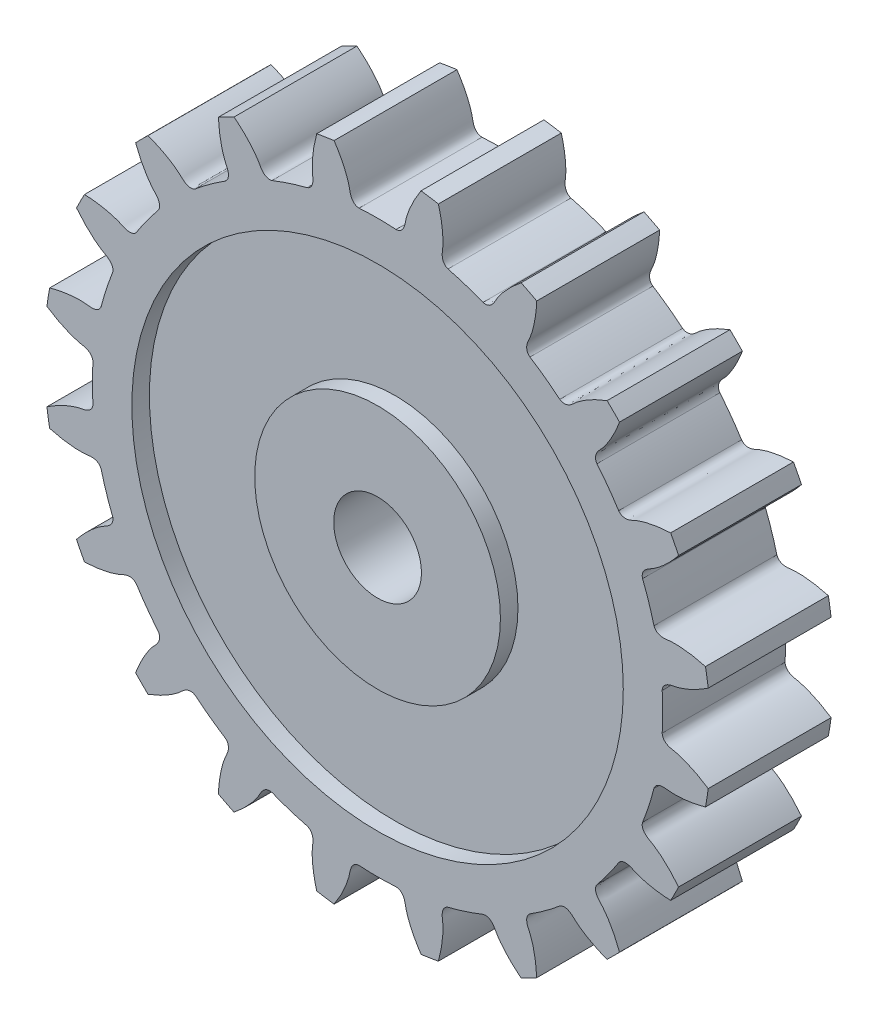
from build123d import *

# Parameters (mm, degrees)
CROQUIS1_R              = 2.5
SALIENTE_EXTRUIR1_DEPTH = 7
CROQUIS2_R              = 14
CROQUIS2_R_2            = 7
CORTAR_EXTRUIR1_DEPTH   = 1
CORTAR_EXTRUIR2_START   = -1
CROQUIS3_R              = 14
CROQUIS3_R_2            = 7
CORTAR_EXTRUIR2_DEPTH   = 1


with BuildPart() as part:
    # Croquis1 → Saliente-Extruir1 (new body)
    with BuildSketch(Plane.XY):
        with BuildLine():
            ThreePointArc((6.009338484, 15.098024738), (5.021526159, 15.45466839), (4.012739321, 15.746759131))
            add(Edge.make_bspline(
                [(4.012739321, 15.746759131), (3.946115444, 15.769102329), (3.844071312, 15.832245409), (3.753150436, 15.958574818), (3.709049528, 16.068220448), (3.687336313, 16.171871712), (3.679630722, 16.27329844), (3.681699682, 16.352274965), (3.686361582, 16.409563995), (3.690140505, 16.445010565), (3.695527746, 16.484388184), (3.704084221, 16.544422236), (3.713446112, 16.632533556), (3.721941557, 16.752412041), (3.726649101, 16.89437231), (3.726023288, 17.058257781), (3.718404355, 17.243841257), (3.702184036, 17.450797585), (3.675756229, 17.678713454), (3.637539698, 17.927084936), (3.572554469, 18.265123942), (3.510335789, 18.518138446), (3.465069654, 18.681362164)],
                knots=[0.032345382, 0.032345382, 0.032345382, 0.032345382, 0.098318952, 0.140640605, 0.17619302, 0.208307484, 0.239484432, 0.271287113, 0.282206678, 0.293329329, 0.304676551, 0.319437818, 0.350137192, 0.387658647, 0.432002182, 0.483167798, 0.541155495, 0.605965273, 0.677597132, 0.756051072, 0.841327094, 1, 1, 1, 1], degree=3))
            ThreePointArc((3.465069654, 18.681362164), (2.972254836, 18.766078471), (2.477381313, 18.837796629))
            add(Edge.make_bspline(
                [(2.477381313, 18.837796629), (2.383891758, 18.696549653), (2.246532494, 18.47514519), (2.080268072, 18.173732531), (1.967170982, 17.949326772), (1.871606768, 17.740732541), (1.792227304, 17.548917731), (1.727632821, 17.374771737), (1.676394242, 17.219100778), (1.637003247, 17.082633828), (1.608038406, 16.965997377), (1.589714197, 16.879305549), (1.579300347, 16.819565676), (1.572255564, 16.780450587), (1.564895941, 16.745571144), (1.551626388, 16.689645432), (1.529188997, 16.613894949), (1.490517962, 16.519813557), (1.437837465, 16.427945099), (1.362012645, 16.337293839), (1.23650382, 16.245243527), (1.119941798, 16.216724261), (1.049674299, 16.216062527)],
                knots=[0, 0, 0, 0, 0.158672906, 0.243948928, 0.322402868, 0.394034727, 0.458844505, 0.516832202, 0.567997818, 0.612341353, 0.649862808, 0.680562182, 0.695323449, 0.706670671, 0.717793322, 0.728712887, 0.760515568, 0.791692516, 0.82380698, 0.859359395, 0.901681048, 0.967654618, 0.967654618, 0.967654618, 0.967654618], degree=3))
            ThreePointArc((1.049674299, 16.216062527), (0, 16.25), (-1.049674299, 16.216062527))
            add(Edge.make_bspline(
                [(-1.049674299, 16.216062527), (-1.119941798, 16.216724261), (-1.23650382, 16.245243527), (-1.362012645, 16.337293839), (-1.437837465, 16.427945099), (-1.490517962, 16.519813557), (-1.529188997, 16.613894949), (-1.551626388, 16.689645432), (-1.564895941, 16.745571144), (-1.572255564, 16.780450587), (-1.579300347, 16.819565676), (-1.589714197, 16.879305549), (-1.608038406, 16.965997377), (-1.637003247, 17.082633828), (-1.676394242, 17.219100778), (-1.727632821, 17.374771737), (-1.792227304, 17.548917731), (-1.871606768, 17.740732541), (-1.967170982, 17.949326772), (-2.080268072, 18.173732531), (-2.246532494, 18.47514519), (-2.383891758, 18.696549653), (-2.477381313, 18.837796629)],
                knots=[0.032345382, 0.032345382, 0.032345382, 0.032345382, 0.098318952, 0.140640605, 0.17619302, 0.208307484, 0.239484432, 0.271287113, 0.282206678, 0.293329329, 0.304676551, 0.319437818, 0.350137192, 0.387658647, 0.432002182, 0.483167798, 0.541155495, 0.605965273, 0.677597132, 0.756051072, 0.841327094, 1, 1, 1, 1], degree=3))
            ThreePointArc((-2.477381313, 18.837796629), (-2.972254836, 18.766078471), (-3.465069654, 18.681362164))
            add(Edge.make_bspline(
                [(-3.465069654, 18.681362164), (-3.510335789, 18.518138446), (-3.572554469, 18.265123942), (-3.637539698, 17.927084936), (-3.675756229, 17.678713454), (-3.702184036, 17.450797585), (-3.718404355, 17.243841257), (-3.726023288, 17.058257781), (-3.726649101, 16.89437231), (-3.721941557, 16.752412041), (-3.713446112, 16.632533556), (-3.704084221, 16.544422236), (-3.695527746, 16.484388184), (-3.690140505, 16.445010565), (-3.686361582, 16.409563995), (-3.681699682, 16.352274965), (-3.679630722, 16.27329844), (-3.687336313, 16.171871712), (-3.709049528, 16.068220448), (-3.753150436, 15.958574818), (-3.844071312, 15.832245409), (-3.946115444, 15.769102329), (-4.012739321, 15.746759131)],
                knots=[0, 0, 0, 0, 0.158672906, 0.243948928, 0.322402868, 0.394034727, 0.458844505, 0.516832202, 0.567997818, 0.612341353, 0.649862808, 0.680562182, 0.695323449, 0.706670671, 0.717793322, 0.728712887, 0.760515568, 0.791692516, 0.82380698, 0.859359395, 0.901681048, 0.967654618, 0.967654618, 0.967654618, 0.967654618], degree=3))
            ThreePointArc((-4.012739321, 15.746759131), (-5.021526159, 15.45466839), (-6.009338484, 15.098024738))
            add(Edge.make_bspline(
                [(-6.009338484, 15.098024738), (-6.076371335, 15.076940233), (-6.196041343, 15.068044021), (-6.34385244, 15.11680471), (-6.443978909, 15.179588024), (-6.522469953, 15.25068095), (-6.588321042, 15.328207665), (-6.633068455, 15.39331712), (-6.662970546, 15.442405115), (-6.680748304, 15.473303188), (-6.699535518, 15.508326891), (-6.727900314, 15.561924829), (-6.77211692, 15.638711166), (-6.835706767, 15.740688395), (-6.915340436, 15.85830369), (-7.012176192, 15.990521978), (-7.127423268, 16.136183867), (-7.26219166, 16.294080989), (-7.417537791, 16.462934926), (-7.594444709, 16.641408562), (-7.845713205, 16.876690503), (-8.044767369, 17.044812314), (-8.177328936, 17.150256309)],
                knots=[0.032345382, 0.032345382, 0.032345382, 0.032345382, 0.098318952, 0.140640605, 0.17619302, 0.208307484, 0.239484432, 0.271287113, 0.282206678, 0.293329329, 0.304676551, 0.319437818, 0.350137192, 0.387658647, 0.432002182, 0.483167798, 0.541155495, 0.605965273, 0.677597132, 0.756051072, 0.841327094, 1, 1, 1, 1], degree=3))
            ThreePointArc((-8.177328936, 17.150256309), (-8.625819495, 16.92912396), (-9.06833546, 16.696265809))
            add(Edge.make_bspline(
                [(-9.06833546, 16.696265809), (-9.06094721, 16.527042824), (-9.04193491, 16.267185101), (-8.999279738, 15.925609363), (-8.95887481, 15.677584488), (-8.913579271, 15.452656974), (-8.865052689, 15.250817455), (-8.814950277, 15.071962702), (-8.764902064, 14.915904969), (-8.716556788, 14.782347442), (-8.671432651, 14.670961465), (-8.635301069, 14.590055603), (-8.608611834, 14.535603923), (-8.591319911, 14.499818331), (-8.576772349, 14.467274391), (-8.554635334, 14.414229892), (-8.528262548, 14.339758097), (-8.504248418, 14.240914387), (-8.49286891, 14.135626425), (-8.500929004, 14.017719304), (-8.548361961, 13.869476801), (-8.625899413, 13.777890793), (-8.682358057, 13.736053238)],
                knots=[0, 0, 0, 0, 0.158672906, 0.243948928, 0.322402868, 0.394034727, 0.458844505, 0.516832202, 0.567997818, 0.612341353, 0.649862808, 0.680562182, 0.695323449, 0.706670671, 0.717793322, 0.728712887, 0.760515568, 0.791692516, 0.82380698, 0.859359395, 0.901681048, 0.967654618, 0.967654618, 0.967654618, 0.967654618], degree=3))
            ThreePointArc((-8.682358057, 13.736053238), (-9.55151035, 13.146526159), (-10.38076675, 12.502087093))
            add(Edge.make_bspline(
                [(-10.38076675, 12.502087093), (-10.438003309, 12.461320247), (-10.549067169, 12.415879381), (-10.704711757, 12.416577411), (-10.819338799, 12.445347111), (-10.915957141, 12.488705435), (-11.00254232, 12.542088616), (-11.065219567, 12.590183677), (-11.10882717, 12.62762888), (-11.135282852, 12.651521064), (-11.163973475, 12.679025017), (-11.207512672, 12.721234482), (-11.273293447, 12.780598945), (-11.365283681, 12.857934709), (-11.477364926, 12.945185345), (-11.610318901, 13.041008515), (-11.764937383, 13.143927899), (-11.941902634, 13.252451262), (-12.141824321, 13.365036305), (-12.365224184, 13.480107575), (-12.676900843, 13.626227763), (-12.9181651, 13.724609987), (-13.076822628, 13.783929409)],
                knots=[0.032345382, 0.032345382, 0.032345382, 0.032345382, 0.098318952, 0.140640605, 0.17619302, 0.208307484, 0.239484432, 0.271287113, 0.282206678, 0.293329329, 0.304676551, 0.319437818, 0.350137192, 0.387658647, 0.432002182, 0.483167798, 0.541155495, 0.605965273, 0.677597132, 0.756051072, 0.841327094, 1, 1, 1, 1], degree=3))
            ThreePointArc((-13.076822628, 13.783929409), (-13.435028843, 13.435028843), (-13.783929409, 13.076822628))
            add(Edge.make_bspline(
                [(-13.783929409, 13.076822628), (-13.724609987, 12.9181651), (-13.626227763, 12.676900843), (-13.480107575, 12.365224184), (-13.365036305, 12.141824321), (-13.252451262, 11.941902634), (-13.143927899, 11.764937383), (-13.041008515, 11.610318901), (-12.945185345, 11.477364926), (-12.857934709, 11.365283681), (-12.780598945, 11.273293447), (-12.721234482, 11.207512672), (-12.679025017, 11.163973475), (-12.651521064, 11.135282852), (-12.62762888, 11.10882717), (-12.590183677, 11.065219567), (-12.542088616, 11.00254232), (-12.488705435, 10.915957141), (-12.445347111, 10.819338799), (-12.416577411, 10.704711757), (-12.415879381, 10.549067169), (-12.461320247, 10.438003309), (-12.502087093, 10.38076675)],
                knots=[0, 0, 0, 0, 0.158672906, 0.243948928, 0.322402868, 0.394034727, 0.458844505, 0.516832202, 0.567997818, 0.612341353, 0.649862808, 0.680562182, 0.695323449, 0.706670671, 0.717793322, 0.728712887, 0.760515568, 0.791692516, 0.82380698, 0.859359395, 0.901681048, 0.967654618, 0.967654618, 0.967654618, 0.967654618], degree=3))
            ThreePointArc((-12.502087093, 10.38076675), (-13.146526159, 9.55151035), (-13.736053238, 8.682358057))
            add(Edge.make_bspline(
                [(-13.736053238, 8.682358057), (-13.777890793, 8.625899413), (-13.869476801, 8.548361961), (-14.017719304, 8.500929004), (-14.135626425, 8.49286891), (-14.240914387, 8.504248418), (-14.339758097, 8.528262548), (-14.414229892, 8.554635334), (-14.467274391, 8.576772349), (-14.499818331, 8.591319911), (-14.535603923, 8.608611834), (-14.590055603, 8.635301069), (-14.670961465, 8.671432651), (-14.782347442, 8.716556788), (-14.915904969, 8.764902064), (-15.071962702, 8.814950277), (-15.250817455, 8.865052689), (-15.452656974, 8.913579271), (-15.677584488, 8.95887481), (-15.925609363, 8.999279738), (-16.267185101, 9.04193491), (-16.527042824, 9.06094721), (-16.696265809, 9.06833546)],
                knots=[0.032345382, 0.032345382, 0.032345382, 0.032345382, 0.098318952, 0.140640605, 0.17619302, 0.208307484, 0.239484432, 0.271287113, 0.282206678, 0.293329329, 0.304676551, 0.319437818, 0.350137192, 0.387658647, 0.432002182, 0.483167798, 0.541155495, 0.605965273, 0.677597132, 0.756051072, 0.841327094, 1, 1, 1, 1], degree=3))
            ThreePointArc((-16.696265809, 9.06833546), (-16.92912396, 8.625819495), (-17.150256309, 8.177328936))
            add(Edge.make_bspline(
                [(-17.150256309, 8.177328936), (-17.044812314, 8.044767369), (-16.876690503, 7.845713205), (-16.641408562, 7.594444709), (-16.462934926, 7.417537791), (-16.294080989, 7.26219166), (-16.136183867, 7.127423268), (-15.990521978, 7.012176192), (-15.85830369, 6.915340436), (-15.740688395, 6.835706767), (-15.638711166, 6.77211692), (-15.561924829, 6.727900314), (-15.508326891, 6.699535518), (-15.473303188, 6.680748304), (-15.442405115, 6.662970546), (-15.39331712, 6.633068455), (-15.328207665, 6.588321042), (-15.25068095, 6.522469953), (-15.179588024, 6.443978909), (-15.11680471, 6.34385244), (-15.068044021, 6.196041343), (-15.076940233, 6.076371335), (-15.098024738, 6.009338484)],
                knots=[0, 0, 0, 0, 0.158672906, 0.243948928, 0.322402868, 0.394034727, 0.458844505, 0.516832202, 0.567997818, 0.612341353, 0.649862808, 0.680562182, 0.695323449, 0.706670671, 0.717793322, 0.728712887, 0.760515568, 0.791692516, 0.82380698, 0.859359395, 0.901681048, 0.967654618, 0.967654618, 0.967654618, 0.967654618], degree=3))
            ThreePointArc((-15.098024738, 6.009338484), (-15.45466839, 5.021526159), (-15.746759131, 4.012739321))
            add(Edge.make_bspline(
                [(-15.746759131, 4.012739321), (-15.769102329, 3.946115444), (-15.832245409, 3.844071312), (-15.958574818, 3.753150436), (-16.068220448, 3.709049528), (-16.171871712, 3.687336313), (-16.27329844, 3.679630722), (-16.352274965, 3.681699682), (-16.409563995, 3.686361582), (-16.445010565, 3.690140505), (-16.484388184, 3.695527746), (-16.544422236, 3.704084221), (-16.632533556, 3.713446112), (-16.752412041, 3.721941557), (-16.89437231, 3.726649101), (-17.058257781, 3.726023288), (-17.243841257, 3.718404355), (-17.450797585, 3.702184036), (-17.678713454, 3.675756229), (-17.927084936, 3.637539698), (-18.265123942, 3.572554469), (-18.518138446, 3.510335789), (-18.681362164, 3.465069654)],
                knots=[0.032345382, 0.032345382, 0.032345382, 0.032345382, 0.098318952, 0.140640605, 0.17619302, 0.208307484, 0.239484432, 0.271287113, 0.282206678, 0.293329329, 0.304676551, 0.319437818, 0.350137192, 0.387658647, 0.432002182, 0.483167798, 0.541155495, 0.605965273, 0.677597132, 0.756051072, 0.841327094, 1, 1, 1, 1], degree=3))
            ThreePointArc((-18.681362164, 3.465069654), (-18.766078471, 2.972254836), (-18.837796629, 2.477381313))
            add(Edge.make_bspline(
                [(-18.837796629, 2.477381313), (-18.696549653, 2.383891758), (-18.47514519, 2.246532494), (-18.173732531, 2.080268072), (-17.949326772, 1.967170982), (-17.740732541, 1.871606768), (-17.548917731, 1.792227304), (-17.374771737, 1.727632821), (-17.219100778, 1.676394242), (-17.082633828, 1.637003247), (-16.965997377, 1.608038406), (-16.879305549, 1.589714197), (-16.819565676, 1.579300347), (-16.780450587, 1.572255564), (-16.745571144, 1.564895941), (-16.689645432, 1.551626388), (-16.613894949, 1.529188997), (-16.519813557, 1.490517962), (-16.427945099, 1.437837465), (-16.337293839, 1.362012645), (-16.245243527, 1.23650382), (-16.216724261, 1.119941798), (-16.216062527, 1.049674299)],
                knots=[0, 0, 0, 0, 0.158672906, 0.243948928, 0.322402868, 0.394034727, 0.458844505, 0.516832202, 0.567997818, 0.612341353, 0.649862808, 0.680562182, 0.695323449, 0.706670671, 0.717793322, 0.728712887, 0.760515568, 0.791692516, 0.82380698, 0.859359395, 0.901681048, 0.967654618, 0.967654618, 0.967654618, 0.967654618], degree=3))
            ThreePointArc((-16.216062527, 1.049674299), (-16.25, 0), (-16.216062527, -1.049674299))
            add(Edge.make_bspline(
                [(-16.216062527, -1.049674299), (-16.216724261, -1.119941798), (-16.245243527, -1.23650382), (-16.337293839, -1.362012645), (-16.427945099, -1.437837465), (-16.519813557, -1.490517962), (-16.613894949, -1.529188997), (-16.689645432, -1.551626388), (-16.745571144, -1.564895941), (-16.780450587, -1.572255564), (-16.819565676, -1.579300347), (-16.879305549, -1.589714197), (-16.965997377, -1.608038406), (-17.082633828, -1.637003247), (-17.219100778, -1.676394242), (-17.374771737, -1.727632821), (-17.548917731, -1.792227304), (-17.740732541, -1.871606768), (-17.949326772, -1.967170982), (-18.173732531, -2.080268072), (-18.47514519, -2.246532494), (-18.696549653, -2.383891758), (-18.837796629, -2.477381313)],
                knots=[0.032345382, 0.032345382, 0.032345382, 0.032345382, 0.098318952, 0.140640605, 0.17619302, 0.208307484, 0.239484432, 0.271287113, 0.282206678, 0.293329329, 0.304676551, 0.319437818, 0.350137192, 0.387658647, 0.432002182, 0.483167798, 0.541155495, 0.605965273, 0.677597132, 0.756051072, 0.841327094, 1, 1, 1, 1], degree=3))
            ThreePointArc((-18.837796629, -2.477381313), (-18.766078471, -2.972254836), (-18.681362164, -3.465069654))
            add(Edge.make_bspline(
                [(-18.681362164, -3.465069654), (-18.518138446, -3.510335789), (-18.265123942, -3.572554469), (-17.927084936, -3.637539698), (-17.678713454, -3.675756229), (-17.450797585, -3.702184036), (-17.243841257, -3.718404355), (-17.058257781, -3.726023288), (-16.89437231, -3.726649101), (-16.752412041, -3.721941557), (-16.632533556, -3.713446112), (-16.544422236, -3.704084221), (-16.484388184, -3.695527746), (-16.445010565, -3.690140505), (-16.409563995, -3.686361582), (-16.352274965, -3.681699682), (-16.27329844, -3.679630722), (-16.171871712, -3.687336313), (-16.068220448, -3.709049528), (-15.958574818, -3.753150436), (-15.832245409, -3.844071312), (-15.769102329, -3.946115444), (-15.746759131, -4.012739321)],
                knots=[0, 0, 0, 0, 0.158672906, 0.243948928, 0.322402868, 0.394034727, 0.458844505, 0.516832202, 0.567997818, 0.612341353, 0.649862808, 0.680562182, 0.695323449, 0.706670671, 0.717793322, 0.728712887, 0.760515568, 0.791692516, 0.82380698, 0.859359395, 0.901681048, 0.967654618, 0.967654618, 0.967654618, 0.967654618], degree=3))
            ThreePointArc((-15.746759131, -4.012739321), (-15.45466839, -5.021526159), (-15.098024738, -6.009338484))
            add(Edge.make_bspline(
                [(-15.098024738, -6.009338484), (-15.076940233, -6.076371335), (-15.068044021, -6.196041343), (-15.11680471, -6.34385244), (-15.179588024, -6.443978909), (-15.25068095, -6.522469953), (-15.328207665, -6.588321042), (-15.39331712, -6.633068455), (-15.442405115, -6.662970546), (-15.473303188, -6.680748304), (-15.508326891, -6.699535518), (-15.561924829, -6.727900314), (-15.638711166, -6.77211692), (-15.740688395, -6.835706767), (-15.85830369, -6.915340436), (-15.990521978, -7.012176192), (-16.136183867, -7.127423268), (-16.294080989, -7.26219166), (-16.462934926, -7.417537791), (-16.641408562, -7.594444709), (-16.876690503, -7.845713205), (-17.044812314, -8.044767369), (-17.150256309, -8.177328936)],
                knots=[0.032345382, 0.032345382, 0.032345382, 0.032345382, 0.098318952, 0.140640605, 0.17619302, 0.208307484, 0.239484432, 0.271287113, 0.282206678, 0.293329329, 0.304676551, 0.319437818, 0.350137192, 0.387658647, 0.432002182, 0.483167798, 0.541155495, 0.605965273, 0.677597132, 0.756051072, 0.841327094, 1, 1, 1, 1], degree=3))
            ThreePointArc((-17.150256309, -8.177328936), (-16.92912396, -8.625819495), (-16.696265809, -9.06833546))
            add(Edge.make_bspline(
                [(-16.696265809, -9.06833546), (-16.527042824, -9.06094721), (-16.267185101, -9.04193491), (-15.925609363, -8.999279738), (-15.677584488, -8.95887481), (-15.452656974, -8.913579271), (-15.250817455, -8.865052689), (-15.071962702, -8.814950277), (-14.915904969, -8.764902064), (-14.782347442, -8.716556788), (-14.670961465, -8.671432651), (-14.590055603, -8.635301069), (-14.535603923, -8.608611834), (-14.499818331, -8.591319911), (-14.467274391, -8.576772349), (-14.414229892, -8.554635334), (-14.339758097, -8.528262548), (-14.240914387, -8.504248418), (-14.135626425, -8.49286891), (-14.017719304, -8.500929004), (-13.869476801, -8.548361961), (-13.777890793, -8.625899413), (-13.736053238, -8.682358057)],
                knots=[0, 0, 0, 0, 0.158672906, 0.243948928, 0.322402868, 0.394034727, 0.458844505, 0.516832202, 0.567997818, 0.612341353, 0.649862808, 0.680562182, 0.695323449, 0.706670671, 0.717793322, 0.728712887, 0.760515568, 0.791692516, 0.82380698, 0.859359395, 0.901681048, 0.967654618, 0.967654618, 0.967654618, 0.967654618], degree=3))
            ThreePointArc((-13.736053238, -8.682358057), (-13.146526159, -9.55151035), (-12.502087093, -10.38076675))
            add(Edge.make_bspline(
                [(-12.502087093, -10.38076675), (-12.461320247, -10.438003309), (-12.415879381, -10.549067169), (-12.416577411, -10.704711757), (-12.445347111, -10.819338799), (-12.488705435, -10.915957141), (-12.542088616, -11.00254232), (-12.590183677, -11.065219567), (-12.62762888, -11.10882717), (-12.651521064, -11.135282852), (-12.679025017, -11.163973475), (-12.721234482, -11.207512672), (-12.780598945, -11.273293447), (-12.857934709, -11.365283681), (-12.945185345, -11.477364926), (-13.041008515, -11.610318901), (-13.143927899, -11.764937383), (-13.252451262, -11.941902634), (-13.365036305, -12.141824321), (-13.480107575, -12.365224184), (-13.626227763, -12.676900843), (-13.724609987, -12.9181651), (-13.783929409, -13.076822628)],
                knots=[0.032345382, 0.032345382, 0.032345382, 0.032345382, 0.098318952, 0.140640605, 0.17619302, 0.208307484, 0.239484432, 0.271287113, 0.282206678, 0.293329329, 0.304676551, 0.319437818, 0.350137192, 0.387658647, 0.432002182, 0.483167798, 0.541155495, 0.605965273, 0.677597132, 0.756051072, 0.841327094, 1, 1, 1, 1], degree=3))
            ThreePointArc((-13.783929409, -13.076822628), (-13.435028843, -13.435028843), (-13.076822628, -13.783929409))
            add(Edge.make_bspline(
                [(-13.076822628, -13.783929409), (-12.9181651, -13.724609987), (-12.676900843, -13.626227763), (-12.365224184, -13.480107575), (-12.141824321, -13.365036305), (-11.941902634, -13.252451262), (-11.764937383, -13.143927899), (-11.610318901, -13.041008515), (-11.477364926, -12.945185345), (-11.365283681, -12.857934709), (-11.273293447, -12.780598945), (-11.207512672, -12.721234482), (-11.163973475, -12.679025017), (-11.135282852, -12.651521064), (-11.10882717, -12.62762888), (-11.065219567, -12.590183677), (-11.00254232, -12.542088616), (-10.915957141, -12.488705435), (-10.819338799, -12.445347111), (-10.704711757, -12.416577411), (-10.549067169, -12.415879381), (-10.438003309, -12.461320247), (-10.38076675, -12.502087093)],
                knots=[0, 0, 0, 0, 0.158672906, 0.243948928, 0.322402868, 0.394034727, 0.458844505, 0.516832202, 0.567997818, 0.612341353, 0.649862808, 0.680562182, 0.695323449, 0.706670671, 0.717793322, 0.728712887, 0.760515568, 0.791692516, 0.82380698, 0.859359395, 0.901681048, 0.967654618, 0.967654618, 0.967654618, 0.967654618], degree=3))
            ThreePointArc((-10.38076675, -12.502087093), (-9.55151035, -13.146526159), (-8.682358057, -13.736053238))
            add(Edge.make_bspline(
                [(-8.682358057, -13.736053238), (-8.625899413, -13.777890793), (-8.548361961, -13.869476801), (-8.500929004, -14.017719304), (-8.49286891, -14.135626425), (-8.504248418, -14.240914387), (-8.528262548, -14.339758097), (-8.554635334, -14.414229892), (-8.576772349, -14.467274391), (-8.591319911, -14.499818331), (-8.608611834, -14.535603923), (-8.635301069, -14.590055603), (-8.671432651, -14.670961465), (-8.716556788, -14.782347442), (-8.764902064, -14.915904969), (-8.814950277, -15.071962702), (-8.865052689, -15.250817455), (-8.913579271, -15.452656974), (-8.95887481, -15.677584488), (-8.999279738, -15.925609363), (-9.04193491, -16.267185101), (-9.06094721, -16.527042824), (-9.06833546, -16.696265809)],
                knots=[0.032345382, 0.032345382, 0.032345382, 0.032345382, 0.098318952, 0.140640605, 0.17619302, 0.208307484, 0.239484432, 0.271287113, 0.282206678, 0.293329329, 0.304676551, 0.319437818, 0.350137192, 0.387658647, 0.432002182, 0.483167798, 0.541155495, 0.605965273, 0.677597132, 0.756051072, 0.841327094, 1, 1, 1, 1], degree=3))
            ThreePointArc((-9.06833546, -16.696265809), (-8.625819495, -16.92912396), (-8.177328936, -17.150256309))
            add(Edge.make_bspline(
                [(-8.177328936, -17.150256309), (-8.044767369, -17.044812314), (-7.845713205, -16.876690503), (-7.594444709, -16.641408562), (-7.417537791, -16.462934926), (-7.26219166, -16.294080989), (-7.127423268, -16.136183867), (-7.012176192, -15.990521978), (-6.915340436, -15.85830369), (-6.835706767, -15.740688395), (-6.77211692, -15.638711166), (-6.727900314, -15.561924829), (-6.699535518, -15.508326891), (-6.680748304, -15.473303188), (-6.662970546, -15.442405115), (-6.633068455, -15.39331712), (-6.588321042, -15.328207665), (-6.522469953, -15.25068095), (-6.443978909, -15.179588024), (-6.34385244, -15.11680471), (-6.196041343, -15.068044021), (-6.076371335, -15.076940233), (-6.009338484, -15.098024738)],
                knots=[0, 0, 0, 0, 0.158672906, 0.243948928, 0.322402868, 0.394034727, 0.458844505, 0.516832202, 0.567997818, 0.612341353, 0.649862808, 0.680562182, 0.695323449, 0.706670671, 0.717793322, 0.728712887, 0.760515568, 0.791692516, 0.82380698, 0.859359395, 0.901681048, 0.967654618, 0.967654618, 0.967654618, 0.967654618], degree=3))
            ThreePointArc((-6.009338484, -15.098024738), (-5.021526159, -15.45466839), (-4.012739321, -15.746759131))
            add(Edge.make_bspline(
                [(-4.012739321, -15.746759131), (-3.946115444, -15.769102329), (-3.844071312, -15.832245409), (-3.753150437, -15.958574818), (-3.709049528, -16.068220448), (-3.687336313, -16.171871712), (-3.679630722, -16.27329844), (-3.681699682, -16.352274965), (-3.686361582, -16.409563995), (-3.690140505, -16.445010565), (-3.695527746, -16.484388184), (-3.704084221, -16.544422236), (-3.713446112, -16.632533556), (-3.721941557, -16.752412041), (-3.726649101, -16.89437231), (-3.726023288, -17.058257781), (-3.718404355, -17.243841257), (-3.702184036, -17.450797585), (-3.675756229, -17.678713454), (-3.637539698, -17.927084936), (-3.572554469, -18.265123942), (-3.510335789, -18.518138446), (-3.465069654, -18.681362164)],
                knots=[0.032345382, 0.032345382, 0.032345382, 0.032345382, 0.098318952, 0.140640605, 0.17619302, 0.208307484, 0.239484432, 0.271287113, 0.282206678, 0.293329329, 0.304676551, 0.319437818, 0.350137192, 0.387658647, 0.432002182, 0.483167798, 0.541155495, 0.605965273, 0.677597132, 0.756051072, 0.841327094, 1, 1, 1, 1], degree=3))
            ThreePointArc((-3.465069654, -18.681362164), (-2.972254836, -18.766078471), (-2.477381313, -18.837796629))
            add(Edge.make_bspline(
                [(-2.477381313, -18.837796629), (-2.383891758, -18.696549653), (-2.246532494, -18.47514519), (-2.080268072, -18.173732531), (-1.967170982, -17.949326772), (-1.871606768, -17.740732541), (-1.792227304, -17.548917731), (-1.727632821, -17.374771737), (-1.676394242, -17.219100778), (-1.637003247, -17.082633828), (-1.608038406, -16.965997377), (-1.589714197, -16.879305549), (-1.579300347, -16.819565676), (-1.572255564, -16.780450587), (-1.564895941, -16.745571144), (-1.551626388, -16.689645432), (-1.529188997, -16.613894949), (-1.490517962, -16.519813557), (-1.437837465, -16.427945099), (-1.362012645, -16.337293839), (-1.23650382, -16.245243527), (-1.119941798, -16.216724261), (-1.049674299, -16.216062527)],
                knots=[0, 0, 0, 0, 0.158672906, 0.243948928, 0.322402868, 0.394034727, 0.458844505, 0.516832202, 0.567997818, 0.612341353, 0.649862808, 0.680562182, 0.695323449, 0.706670671, 0.717793322, 0.728712887, 0.760515568, 0.791692516, 0.82380698, 0.859359395, 0.901681048, 0.967654618, 0.967654618, 0.967654618, 0.967654618], degree=3))
            ThreePointArc((-1.049674299, -16.216062527), (0, -16.25), (1.049674299, -16.216062527))
            add(Edge.make_bspline(
                [(1.049674299, -16.216062527), (1.119941798, -16.216724261), (1.23650382, -16.245243527), (1.362012645, -16.337293839), (1.437837465, -16.427945099), (1.490517962, -16.519813557), (1.529188997, -16.613894949), (1.551626388, -16.689645432), (1.564895941, -16.745571144), (1.572255564, -16.780450587), (1.579300347, -16.819565676), (1.589714197, -16.879305549), (1.608038406, -16.965997377), (1.637003247, -17.082633828), (1.676394242, -17.219100778), (1.727632821, -17.374771737), (1.792227304, -17.548917731), (1.871606768, -17.740732541), (1.967170982, -17.949326772), (2.080268072, -18.173732531), (2.246532494, -18.47514519), (2.383891758, -18.696549653), (2.477381313, -18.837796629)],
                knots=[0.032345382, 0.032345382, 0.032345382, 0.032345382, 0.098318952, 0.140640605, 0.17619302, 0.208307484, 0.239484432, 0.271287113, 0.282206678, 0.293329329, 0.304676551, 0.319437818, 0.350137192, 0.387658647, 0.432002182, 0.483167798, 0.541155495, 0.605965273, 0.677597132, 0.756051072, 0.841327094, 1, 1, 1, 1], degree=3))
            ThreePointArc((2.477381313, -18.837796629), (2.972254836, -18.766078471), (3.465069654, -18.681362164))
            add(Edge.make_bspline(
                [(3.465069654, -18.681362164), (3.510335789, -18.518138446), (3.572554469, -18.265123942), (3.637539698, -17.927084936), (3.675756229, -17.678713454), (3.702184036, -17.450797585), (3.718404355, -17.243841257), (3.726023288, -17.058257781), (3.726649101, -16.89437231), (3.721941557, -16.752412041), (3.713446112, -16.632533556), (3.704084221, -16.544422236), (3.695527746, -16.484388184), (3.690140505, -16.445010565), (3.686361582, -16.409563995), (3.681699682, -16.352274965), (3.679630722, -16.27329844), (3.687336313, -16.171871712), (3.709049528, -16.068220448), (3.753150436, -15.958574818), (3.844071312, -15.832245409), (3.946115444, -15.769102329), (4.012739321, -15.746759131)],
                knots=[0, 0, 0, 0, 0.158672906, 0.243948928, 0.322402868, 0.394034727, 0.458844505, 0.516832202, 0.567997818, 0.612341353, 0.649862808, 0.680562182, 0.695323449, 0.706670671, 0.717793322, 0.728712887, 0.760515568, 0.791692516, 0.82380698, 0.859359395, 0.901681048, 0.967654618, 0.967654618, 0.967654618, 0.967654618], degree=3))
            ThreePointArc((4.012739321, -15.746759131), (5.021526159, -15.45466839), (6.009338484, -15.098024738))
            add(Edge.make_bspline(
                [(6.009338484, -15.098024738), (6.076371335, -15.076940233), (6.196041343, -15.068044021), (6.34385244, -15.11680471), (6.443978909, -15.179588024), (6.522469953, -15.25068095), (6.588321042, -15.328207665), (6.633068455, -15.39331712), (6.662970546, -15.442405115), (6.680748304, -15.473303188), (6.699535518, -15.508326891), (6.727900314, -15.561924829), (6.77211692, -15.638711166), (6.835706767, -15.740688395), (6.915340436, -15.85830369), (7.012176192, -15.990521978), (7.127423268, -16.136183867), (7.26219166, -16.294080989), (7.417537791, -16.462934926), (7.594444709, -16.641408562), (7.845713205, -16.876690503), (8.044767369, -17.044812314), (8.177328936, -17.150256309)],
                knots=[0.032345382, 0.032345382, 0.032345382, 0.032345382, 0.098318952, 0.140640605, 0.17619302, 0.208307484, 0.239484432, 0.271287113, 0.282206678, 0.293329329, 0.304676551, 0.319437818, 0.350137192, 0.387658647, 0.432002182, 0.483167798, 0.541155495, 0.605965273, 0.677597132, 0.756051072, 0.841327094, 1, 1, 1, 1], degree=3))
            ThreePointArc((8.177328936, -17.150256309), (8.625819495, -16.92912396), (9.06833546, -16.696265809))
            add(Edge.make_bspline(
                [(9.06833546, -16.696265809), (9.06094721, -16.527042824), (9.04193491, -16.267185101), (8.999279738, -15.925609363), (8.95887481, -15.677584488), (8.913579271, -15.452656974), (8.865052689, -15.250817455), (8.814950277, -15.071962702), (8.764902064, -14.915904969), (8.716556788, -14.782347442), (8.671432651, -14.670961465), (8.635301069, -14.590055603), (8.608611834, -14.535603923), (8.591319911, -14.499818331), (8.576772349, -14.467274391), (8.554635334, -14.414229892), (8.528262548, -14.339758097), (8.504248418, -14.240914387), (8.49286891, -14.135626425), (8.500929004, -14.017719304), (8.548361961, -13.869476801), (8.625899413, -13.777890793), (8.682358057, -13.736053238)],
                knots=[0, 0, 0, 0, 0.158672906, 0.243948928, 0.322402868, 0.394034727, 0.458844505, 0.516832202, 0.567997818, 0.612341353, 0.649862808, 0.680562182, 0.695323449, 0.706670671, 0.717793322, 0.728712887, 0.760515568, 0.791692516, 0.82380698, 0.859359395, 0.901681048, 0.967654618, 0.967654618, 0.967654618, 0.967654618], degree=3))
            ThreePointArc((8.682358057, -13.736053238), (9.55151035, -13.146526159), (10.38076675, -12.502087093))
            add(Edge.make_bspline(
                [(10.38076675, -12.502087093), (10.438003309, -12.461320247), (10.549067169, -12.415879381), (10.704711757, -12.416577411), (10.819338799, -12.445347111), (10.915957141, -12.488705435), (11.00254232, -12.542088616), (11.065219567, -12.590183677), (11.10882717, -12.62762888), (11.135282852, -12.651521064), (11.163973475, -12.679025017), (11.207512672, -12.721234482), (11.273293447, -12.780598945), (11.365283681, -12.857934709), (11.477364926, -12.945185345), (11.610318901, -13.041008515), (11.764937383, -13.143927899), (11.941902634, -13.252451262), (12.141824321, -13.365036305), (12.365224184, -13.480107575), (12.676900843, -13.626227763), (12.9181651, -13.724609987), (13.076822628, -13.783929409)],
                knots=[0.032345382, 0.032345382, 0.032345382, 0.032345382, 0.098318952, 0.140640605, 0.17619302, 0.208307484, 0.239484432, 0.271287113, 0.282206678, 0.293329329, 0.304676551, 0.319437818, 0.350137192, 0.387658647, 0.432002182, 0.483167798, 0.541155495, 0.605965273, 0.677597132, 0.756051072, 0.841327094, 1, 1, 1, 1], degree=3))
            ThreePointArc((13.076822628, -13.783929409), (13.435028843, -13.435028843), (13.783929409, -13.076822628))
            add(Edge.make_bspline(
                [(13.783929409, -13.076822628), (13.724609987, -12.9181651), (13.626227763, -12.676900843), (13.480107575, -12.365224184), (13.365036305, -12.141824321), (13.252451262, -11.941902634), (13.143927899, -11.764937383), (13.041008515, -11.610318901), (12.945185345, -11.477364926), (12.857934709, -11.365283681), (12.780598945, -11.273293447), (12.721234482, -11.207512672), (12.679025017, -11.163973475), (12.651521064, -11.135282852), (12.62762888, -11.10882717), (12.590183677, -11.065219567), (12.542088616, -11.00254232), (12.488705435, -10.915957141), (12.445347111, -10.819338799), (12.416577411, -10.704711757), (12.415879381, -10.549067169), (12.461320247, -10.438003309), (12.502087093, -10.38076675)],
                knots=[0, 0, 0, 0, 0.158672906, 0.243948928, 0.322402868, 0.394034727, 0.458844505, 0.516832202, 0.567997818, 0.612341353, 0.649862808, 0.680562182, 0.695323449, 0.706670671, 0.717793322, 0.728712887, 0.760515568, 0.791692516, 0.82380698, 0.859359395, 0.901681048, 0.967654618, 0.967654618, 0.967654618, 0.967654618], degree=3))
            ThreePointArc((12.502087093, -10.38076675), (13.146526159, -9.55151035), (13.736053238, -8.682358057))
            add(Edge.make_bspline(
                [(13.736053238, -8.682358057), (13.777890793, -8.625899413), (13.869476801, -8.548361961), (14.017719304, -8.500929004), (14.135626425, -8.49286891), (14.240914387, -8.504248418), (14.339758097, -8.528262548), (14.414229892, -8.554635334), (14.467274391, -8.576772349), (14.499818331, -8.591319911), (14.535603923, -8.608611834), (14.590055603, -8.635301069), (14.670961465, -8.671432651), (14.782347442, -8.716556788), (14.915904969, -8.764902064), (15.071962702, -8.814950277), (15.250817455, -8.865052689), (15.452656974, -8.913579271), (15.677584488, -8.95887481), (15.925609363, -8.999279738), (16.267185101, -9.04193491), (16.527042824, -9.06094721), (16.696265809, -9.06833546)],
                knots=[0.032345382, 0.032345382, 0.032345382, 0.032345382, 0.098318952, 0.140640605, 0.17619302, 0.208307484, 0.239484432, 0.271287113, 0.282206678, 0.293329329, 0.304676551, 0.319437818, 0.350137192, 0.387658647, 0.432002182, 0.483167798, 0.541155495, 0.605965273, 0.677597132, 0.756051072, 0.841327094, 1, 1, 1, 1], degree=3))
            ThreePointArc((16.696265809, -9.06833546), (16.92912396, -8.625819495), (17.150256309, -8.177328936))
            add(Edge.make_bspline(
                [(17.150256309, -8.177328936), (17.044812314, -8.044767369), (16.876690503, -7.845713205), (16.641408562, -7.594444709), (16.462934926, -7.417537791), (16.294080989, -7.26219166), (16.136183867, -7.127423268), (15.990521978, -7.012176192), (15.85830369, -6.915340436), (15.740688395, -6.835706767), (15.638711166, -6.77211692), (15.561924829, -6.727900314), (15.508326891, -6.699535518), (15.473303188, -6.680748304), (15.442405115, -6.662970546), (15.39331712, -6.633068455), (15.328207665, -6.588321042), (15.25068095, -6.522469953), (15.179588024, -6.443978909), (15.11680471, -6.34385244), (15.068044021, -6.196041343), (15.076940233, -6.076371335), (15.098024738, -6.009338484)],
                knots=[0, 0, 0, 0, 0.158672906, 0.243948928, 0.322402868, 0.394034727, 0.458844505, 0.516832202, 0.567997818, 0.612341353, 0.649862808, 0.680562182, 0.695323449, 0.706670671, 0.717793322, 0.728712887, 0.760515568, 0.791692516, 0.82380698, 0.859359395, 0.901681048, 0.967654618, 0.967654618, 0.967654618, 0.967654618], degree=3))
            ThreePointArc((15.098024738, -6.009338484), (15.45466839, -5.021526159), (15.746759131, -4.012739321))
            add(Edge.make_bspline(
                [(15.746759131, -4.012739321), (15.769102329, -3.946115444), (15.832245409, -3.844071312), (15.958574818, -3.753150437), (16.068220448, -3.709049528), (16.171871712, -3.687336313), (16.27329844, -3.679630722), (16.352274965, -3.681699682), (16.409563995, -3.686361582), (16.445010565, -3.690140505), (16.484388184, -3.695527746), (16.544422236, -3.704084221), (16.632533556, -3.713446112), (16.752412041, -3.721941557), (16.89437231, -3.726649101), (17.058257781, -3.726023288), (17.243841257, -3.718404355), (17.450797585, -3.702184036), (17.678713454, -3.675756229), (17.927084936, -3.637539698), (18.265123942, -3.572554469), (18.518138446, -3.510335789), (18.681362164, -3.465069654)],
                knots=[0.032345382, 0.032345382, 0.032345382, 0.032345382, 0.098318952, 0.140640605, 0.17619302, 0.208307484, 0.239484432, 0.271287113, 0.282206678, 0.293329329, 0.304676551, 0.319437818, 0.350137192, 0.387658647, 0.432002182, 0.483167798, 0.541155495, 0.605965273, 0.677597132, 0.756051072, 0.841327094, 1, 1, 1, 1], degree=3))
            ThreePointArc((18.681362164, -3.465069654), (18.766078471, -2.972254836), (18.837796629, -2.477381313))
            add(Edge.make_bspline(
                [(18.837796629, -2.477381313), (18.696549653, -2.383891758), (18.47514519, -2.246532494), (18.173732531, -2.080268072), (17.949326772, -1.967170982), (17.740732541, -1.871606768), (17.548917731, -1.792227304), (17.374771737, -1.727632821), (17.219100778, -1.676394242), (17.082633828, -1.637003247), (16.965997377, -1.608038406), (16.879305549, -1.589714197), (16.819565676, -1.579300347), (16.780450587, -1.572255564), (16.745571144, -1.564895941), (16.689645432, -1.551626388), (16.613894949, -1.529188997), (16.519813557, -1.490517962), (16.427945099, -1.437837465), (16.337293839, -1.362012645), (16.245243527, -1.23650382), (16.216724261, -1.119941798), (16.216062527, -1.049674299)],
                knots=[0, 0, 0, 0, 0.158672906, 0.243948928, 0.322402868, 0.394034727, 0.458844505, 0.516832202, 0.567997818, 0.612341353, 0.649862808, 0.680562182, 0.695323449, 0.706670671, 0.717793322, 0.728712887, 0.760515568, 0.791692516, 0.82380698, 0.859359395, 0.901681048, 0.967654618, 0.967654618, 0.967654618, 0.967654618], degree=3))
            ThreePointArc((16.216062527, -1.049674299), (16.25, 0), (16.216062527, 1.049674299))
            add(Edge.make_bspline(
                [(16.216062527, 1.049674299), (16.216724261, 1.119941798), (16.245243527, 1.23650382), (16.337293839, 1.362012645), (16.427945099, 1.437837465), (16.519813557, 1.490517962), (16.613894949, 1.529188997), (16.689645432, 1.551626388), (16.745571144, 1.564895941), (16.780450587, 1.572255564), (16.819565676, 1.579300347), (16.879305549, 1.589714197), (16.965997377, 1.608038406), (17.082633828, 1.637003247), (17.219100778, 1.676394242), (17.374771737, 1.727632821), (17.548917731, 1.792227304), (17.740732541, 1.871606768), (17.949326772, 1.967170982), (18.173732531, 2.080268072), (18.47514519, 2.246532494), (18.696549653, 2.383891758), (18.837796629, 2.477381313)],
                knots=[0.032345382, 0.032345382, 0.032345382, 0.032345382, 0.098318952, 0.140640605, 0.17619302, 0.208307484, 0.239484432, 0.271287113, 0.282206678, 0.293329329, 0.304676551, 0.319437818, 0.350137192, 0.387658647, 0.432002182, 0.483167798, 0.541155495, 0.605965273, 0.677597132, 0.756051072, 0.841327094, 1, 1, 1, 1], degree=3))
            ThreePointArc((18.837796629, 2.477381313), (18.766078471, 2.972254836), (18.681362164, 3.465069654))
            add(Edge.make_bspline(
                [(18.681362164, 3.465069654), (18.518138446, 3.510335789), (18.265123942, 3.572554469), (17.927084936, 3.637539698), (17.678713454, 3.675756229), (17.450797585, 3.702184036), (17.243841257, 3.718404355), (17.058257781, 3.726023288), (16.89437231, 3.726649101), (16.752412041, 3.721941557), (16.632533556, 3.713446112), (16.544422236, 3.704084221), (16.484388184, 3.695527746), (16.445010565, 3.690140505), (16.409563995, 3.686361582), (16.352274965, 3.681699682), (16.27329844, 3.679630722), (16.171871712, 3.687336313), (16.068220448, 3.709049528), (15.958574818, 3.753150436), (15.832245409, 3.844071312), (15.769102329, 3.946115444), (15.746759131, 4.012739321)],
                knots=[0, 0, 0, 0, 0.158672906, 0.243948928, 0.322402868, 0.394034727, 0.458844505, 0.516832202, 0.567997818, 0.612341353, 0.649862808, 0.680562182, 0.695323449, 0.706670671, 0.717793322, 0.728712887, 0.760515568, 0.791692516, 0.82380698, 0.859359395, 0.901681048, 0.967654618, 0.967654618, 0.967654618, 0.967654618], degree=3))
            ThreePointArc((15.746759131, 4.012739321), (15.45466839, 5.021526159), (15.098024738, 6.009338484))
            add(Edge.make_bspline(
                [(15.098024738, 6.009338484), (15.076940233, 6.076371335), (15.068044021, 6.196041343), (15.11680471, 6.34385244), (15.179588024, 6.443978909), (15.25068095, 6.522469953), (15.328207665, 6.588321042), (15.39331712, 6.633068455), (15.442405115, 6.662970546), (15.473303188, 6.680748304), (15.508326891, 6.699535518), (15.561924829, 6.727900314), (15.638711166, 6.77211692), (15.740688395, 6.835706767), (15.85830369, 6.915340436), (15.990521978, 7.012176192), (16.136183867, 7.127423268), (16.294080989, 7.26219166), (16.462934926, 7.417537791), (16.641408562, 7.594444709), (16.876690503, 7.845713205), (17.044812314, 8.044767369), (17.150256309, 8.177328936)],
                knots=[0.032345382, 0.032345382, 0.032345382, 0.032345382, 0.098318952, 0.140640605, 0.17619302, 0.208307484, 0.239484432, 0.271287113, 0.282206678, 0.293329329, 0.304676551, 0.319437818, 0.350137192, 0.387658647, 0.432002182, 0.483167798, 0.541155495, 0.605965273, 0.677597132, 0.756051072, 0.841327094, 1, 1, 1, 1], degree=3))
            ThreePointArc((17.150256309, 8.177328936), (16.92912396, 8.625819495), (16.696265809, 9.06833546))
            add(Edge.make_bspline(
                [(16.696265809, 9.06833546), (16.527042824, 9.06094721), (16.267185101, 9.04193491), (15.925609363, 8.999279738), (15.677584488, 8.95887481), (15.452656974, 8.913579271), (15.250817455, 8.865052689), (15.071962702, 8.814950277), (14.915904969, 8.764902064), (14.782347442, 8.716556788), (14.670961465, 8.671432651), (14.590055603, 8.635301069), (14.535603923, 8.608611834), (14.499818331, 8.591319911), (14.467274391, 8.576772349), (14.414229892, 8.554635334), (14.339758097, 8.528262548), (14.240914387, 8.504248418), (14.135626425, 8.49286891), (14.017719304, 8.500929004), (13.869476801, 8.548361961), (13.777890793, 8.625899413), (13.736053238, 8.682358057)],
                knots=[0, 0, 0, 0, 0.158672906, 0.243948928, 0.322402868, 0.394034727, 0.458844505, 0.516832202, 0.567997818, 0.612341353, 0.649862808, 0.680562182, 0.695323449, 0.706670671, 0.717793322, 0.728712887, 0.760515568, 0.791692516, 0.82380698, 0.859359395, 0.901681048, 0.967654618, 0.967654618, 0.967654618, 0.967654618], degree=3))
            ThreePointArc((13.736053238, 8.682358057), (13.146526159, 9.55151035), (12.502087093, 10.38076675))
            add(Edge.make_bspline(
                [(12.502087093, 10.38076675), (12.461320247, 10.438003309), (12.415879381, 10.549067169), (12.416577411, 10.704711757), (12.445347111, 10.819338799), (12.488705435, 10.915957141), (12.542088616, 11.00254232), (12.590183677, 11.065219567), (12.62762888, 11.10882717), (12.651521064, 11.135282852), (12.679025017, 11.163973475), (12.721234482, 11.207512672), (12.780598945, 11.273293447), (12.857934709, 11.365283681), (12.945185345, 11.477364926), (13.041008515, 11.610318901), (13.143927899, 11.764937383), (13.252451262, 11.941902634), (13.365036305, 12.141824321), (13.480107575, 12.365224184), (13.626227763, 12.676900843), (13.724609987, 12.9181651), (13.783929409, 13.076822628)],
                knots=[0.032345382, 0.032345382, 0.032345382, 0.032345382, 0.098318952, 0.140640605, 0.17619302, 0.208307484, 0.239484432, 0.271287113, 0.282206678, 0.293329329, 0.304676551, 0.319437818, 0.350137192, 0.387658647, 0.432002182, 0.483167798, 0.541155495, 0.605965273, 0.677597132, 0.756051072, 0.841327094, 1, 1, 1, 1], degree=3))
            ThreePointArc((13.783929409, 13.076822628), (13.435028843, 13.435028843), (13.076822628, 13.783929409))
            add(Edge.make_bspline(
                [(13.076822628, 13.783929409), (12.9181651, 13.724609987), (12.676900843, 13.626227763), (12.365224184, 13.480107575), (12.141824321, 13.365036305), (11.941902634, 13.252451262), (11.764937383, 13.143927899), (11.610318901, 13.041008515), (11.477364926, 12.945185345), (11.365283681, 12.857934709), (11.273293447, 12.780598945), (11.207512672, 12.721234482), (11.163973475, 12.679025017), (11.135282852, 12.651521064), (11.10882717, 12.62762888), (11.065219567, 12.590183677), (11.00254232, 12.542088616), (10.915957141, 12.488705435), (10.819338799, 12.445347111), (10.704711757, 12.416577411), (10.549067169, 12.415879381), (10.438003309, 12.461320247), (10.38076675, 12.502087093)],
                knots=[0, 0, 0, 0, 0.158672906, 0.243948928, 0.322402868, 0.394034727, 0.458844505, 0.516832202, 0.567997818, 0.612341353, 0.649862808, 0.680562182, 0.695323449, 0.706670671, 0.717793322, 0.728712887, 0.760515568, 0.791692516, 0.82380698, 0.859359395, 0.901681048, 0.967654618, 0.967654618, 0.967654618, 0.967654618], degree=3))
            ThreePointArc((10.38076675, 12.502087093), (9.55151035, 13.146526159), (8.682358057, 13.736053238))
            add(Edge.make_bspline(
                [(8.682358057, 13.736053238), (8.625899413, 13.777890793), (8.548361961, 13.869476801), (8.500929004, 14.017719304), (8.49286891, 14.135626425), (8.504248418, 14.240914387), (8.528262548, 14.339758097), (8.554635334, 14.414229892), (8.576772349, 14.467274391), (8.591319911, 14.499818331), (8.608611834, 14.535603923), (8.635301069, 14.590055603), (8.671432651, 14.670961465), (8.716556788, 14.782347442), (8.764902064, 14.915904969), (8.814950277, 15.071962702), (8.865052689, 15.250817455), (8.913579271, 15.452656974), (8.95887481, 15.677584488), (8.999279738, 15.925609363), (9.04193491, 16.267185101), (9.06094721, 16.527042824), (9.06833546, 16.696265809)],
                knots=[0.032345382, 0.032345382, 0.032345382, 0.032345382, 0.098318952, 0.140640605, 0.17619302, 0.208307484, 0.239484432, 0.271287113, 0.282206678, 0.293329329, 0.304676551, 0.319437818, 0.350137192, 0.387658647, 0.432002182, 0.483167798, 0.541155495, 0.605965273, 0.677597132, 0.756051072, 0.841327094, 1, 1, 1, 1], degree=3))
            ThreePointArc((9.06833546, 16.696265809), (8.625819495, 16.92912396), (8.177328936, 17.150256309))
            add(Edge.make_bspline(
                [(8.177328936, 17.150256309), (8.044767369, 17.044812314), (7.845713205, 16.876690503), (7.594444709, 16.641408562), (7.417537791, 16.462934926), (7.26219166, 16.294080989), (7.127423268, 16.136183867), (7.012176192, 15.990521978), (6.915340436, 15.85830369), (6.835706767, 15.740688395), (6.77211692, 15.638711166), (6.727900314, 15.561924829), (6.699535518, 15.508326891), (6.680748304, 15.473303188), (6.662970546, 15.442405115), (6.633068455, 15.39331712), (6.588321042, 15.328207665), (6.522469953, 15.25068095), (6.443978909, 15.179588024), (6.34385244, 15.11680471), (6.196041343, 15.068044021), (6.076371335, 15.076940233), (6.009338484, 15.098024738)],
                knots=[0, 0, 0, 0, 0.158672906, 0.243948928, 0.322402868, 0.394034727, 0.458844505, 0.516832202, 0.567997818, 0.612341353, 0.649862808, 0.680562182, 0.695323449, 0.706670671, 0.717793322, 0.728712887, 0.760515568, 0.791692516, 0.82380698, 0.859359395, 0.901681048, 0.967654618, 0.967654618, 0.967654618, 0.967654618], degree=3))
        make_face()
        Circle(CROQUIS1_R, mode=Mode.SUBTRACT)
    extrude(amount=SALIENTE_EXTRUIR1_DEPTH)

    # Croquis2 → Cortar-Extruir1 (cut)
    with BuildSketch(Plane.XY.offset(7)):
        Circle(CROQUIS2_R)
        Circle(CROQUIS2_R_2, mode=Mode.SUBTRACT)
    extrude(amount=-CORTAR_EXTRUIR1_DEPTH, mode=Mode.SUBTRACT)

    # Croquis3 → Cortar-Extruir2 (cut)
    with BuildSketch(Plane(origin=(0, 0, 0), x_dir=(-1, 0, 0), z_dir=(0, 0, -1)).offset(CORTAR_EXTRUIR2_START)):
        with Locations(Location((0, 0, 0), (0, 0, 180))):
            Circle(CROQUIS3_R)
        with Locations(Location((0, 0, 0), (0, 0, 180))):
            Circle(CROQUIS3_R_2, mode=Mode.SUBTRACT)
    extrude(amount=CORTAR_EXTRUIR2_DEPTH, mode=Mode.SUBTRACT)


solid = part.part
